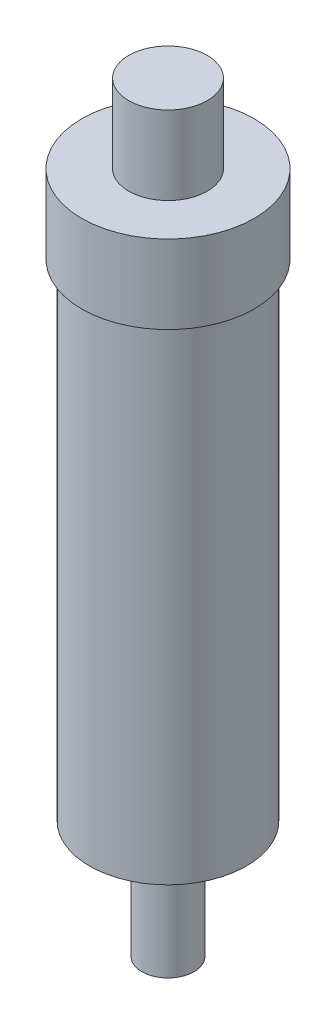
from build123d import *

# Parameters (mm, degrees)
SKETCH2_R          = 1.905
CUT_EXTRUDE1_DEPTH = 38.1


with BuildPart() as part:
    # Sketch1 → Revolve1 (revolve)
    with BuildSketch(Plane.XY, mode=Mode.PRIVATE) as revolve1_sk:
        Polygon((12.7, 182.88), (27.94, 182.88), (27.94, 157.48), (25.4, 157.48), (25.4, 0), (8.450222624, 0), (8.450222624, -38.1), (0, -38.1), (0, 0), (0, 182.88), (0, 208.28), (12.7, 208.28), align=None)
    revolve(revolve1_sk.sketch.rotate(Axis((0, 0, 0), (0, 1, 0)), 90), axis=Axis((0, 0, 0), (0, 1, 0)))

    # Sketch2 → Cut-Extrude1 (cut)
    with BuildSketch(Plane.XZ.offset(38.1)):
        with Locations(Location((0, 0, 0), (0, 0, 270))):
            Circle(SKETCH2_R)
    extrude(amount=-CUT_EXTRUDE1_DEPTH, mode=Mode.SUBTRACT)


solid = part.part
